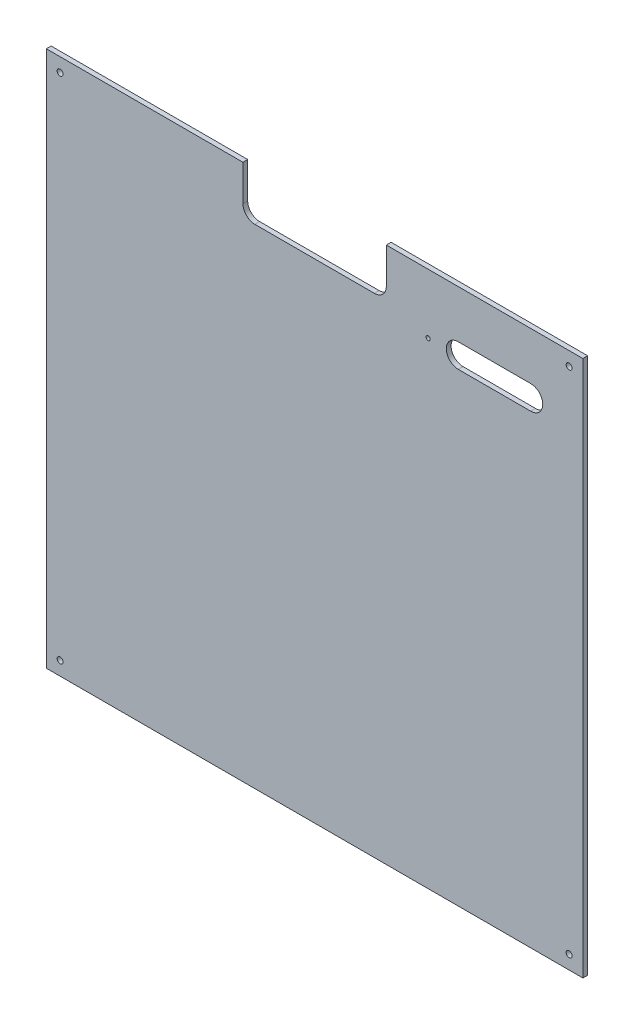
from build123d import *

# Parameters (mm, degrees)
SCHIZZO1_R                   = 2.5
SCHIZZO1_R_2                 = 1.75
ESTRUSIONE_ESTRUSIONE1_DEPTH = 4


with BuildPart() as part:
    # Schizzo1 → Estrusione-Estrusione1 (new body)
    with BuildSketch(Plane.XY):
        with BuildLine():
            Line((0, 0), (0, 449))
            Line((0, 449), (164.5, 449))
            Line((164.5, 449), (164.5, 419))
            ThreePointArc((164.5, 419), (167.428932188, 411.928932188), (174.5, 409))
            Line((174.5, 409), (274.5, 409))
            ThreePointArc((274.5, 409), (281.571067812, 411.928932188), (284.5, 419))
            Line((284.5, 419), (284.5, 449))
            Line((284.5, 449), (449, 449))
            Line((449, 449), (449, 0))
            Line((449, 0), (0, 0))
        make_face()
        with Locations((11.5, 11.5)):
            Circle(SCHIZZO1_R, mode=Mode.SUBTRACT)
        with Locations(Location((437.5, 11.5, 0), (0, 0, 180))):
            Circle(SCHIZZO1_R, mode=Mode.SUBTRACT)
        with Locations((437.5, 437.5)):
            Circle(SCHIZZO1_R, mode=Mode.SUBTRACT)
        with Locations(Location((11.5, 437.5, 0), (0, 0, 180))):
            Circle(SCHIZZO1_R, mode=Mode.SUBTRACT)
        with Locations((319.5, 399)):
            Circle(SCHIZZO1_R_2, mode=Mode.SUBTRACT)
        with BuildLine():
            Line((344.715899345, 409), (405.440355678, 409))
            ThreePointArc((405.440355678, 409), (415.440355678, 399), (405.440355678, 389))
            Line((405.440355678, 389), (344.715899345, 389))
            ThreePointArc((344.715899345, 389), (334.715899345, 399), (344.715899345, 409))
        make_face(mode=Mode.SUBTRACT)
    extrude(amount=ESTRUSIONE_ESTRUSIONE1_DEPTH)


solid = part.part
